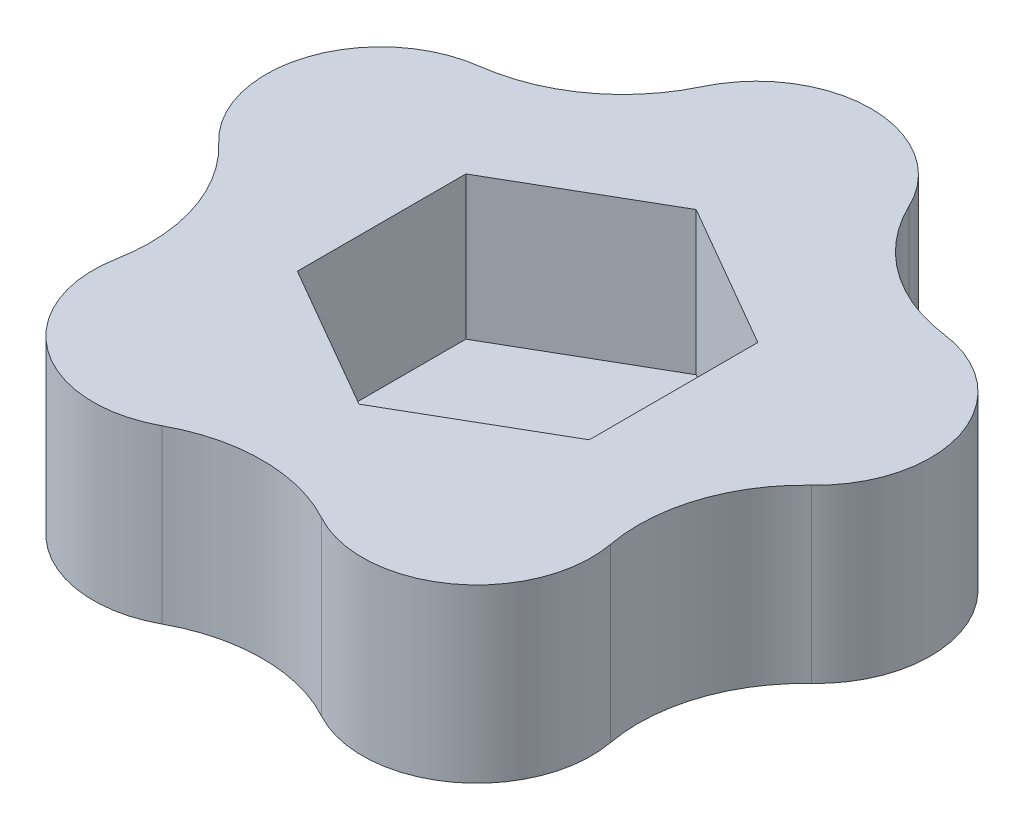
from build123d import *

# Parameters (mm, degrees)
BOSS_EXTRUDE1_DEPTH = 6
CUT_EXTRUDE1_DEPTH  = 5


with BuildPart() as part:
    # Sketch1 → Boss-Extrude1 (new body)
    with BuildSketch(Plane(origin=(0, 0, 0), x_dir=(1, 0, 0), z_dir=(0, 1, 0))):
        with BuildLine():
            ThreePointArc((-3.614057951, 9.714230186), (0, 12), (3.614057951, 9.714230186))
            ThreePointArc((3.614057951, 9.714230186), (5.450234482, 7.501604203), (8.121976593, 6.439035579))
            ThreePointArc((8.121976593, 6.439035579), (11.412678196, 3.708203932), (10.355587244, -0.43531115))
            ThreePointArc((10.355587244, -0.43531115), (8.818664639, -2.865357836), (8.633715541, -5.734687343))
            ThreePointArc((8.633715541, -5.734687343), (7.053423028, -9.708203932), (2.78604694, -9.983267272))
            ThreePointArc((2.78604694, -9.983267272), (0, -9.272492736), (-2.78604694, -9.983267272))
            ThreePointArc((-2.78604694, -9.983267272), (-7.053423028, -9.708203932), (-8.633715541, -5.734687343))
            ThreePointArc((-8.633715541, -5.734687343), (-8.818664639, -2.865357836), (-10.355587244, -0.43531115))
            ThreePointArc((-10.355587244, -0.43531115), (-11.412678196, 3.708203932), (-8.121976593, 6.439035579))
            ThreePointArc((-8.121976593, 6.439035579), (-5.450234482, 7.501604203), (-3.614057951, 9.714230186))
        make_face()
    extrude(amount=BOSS_EXTRUDE1_DEPTH)

    # Sketch2 → Cut-Extrude1 (cut)
    with BuildSketch(Plane(origin=(0, 6, 0), x_dir=(1, 0, 0), z_dir=(0, 1, 0))):
        Polygon((-5.1, 2.944486373), (-5.1, -2.944486373), (0, -5.888972746), (5.1, -2.944486373), (5.1, 2.944486373), (0, 5.888972746), align=None)
    extrude(amount=-CUT_EXTRUDE1_DEPTH, mode=Mode.SUBTRACT)


solid = part.part
